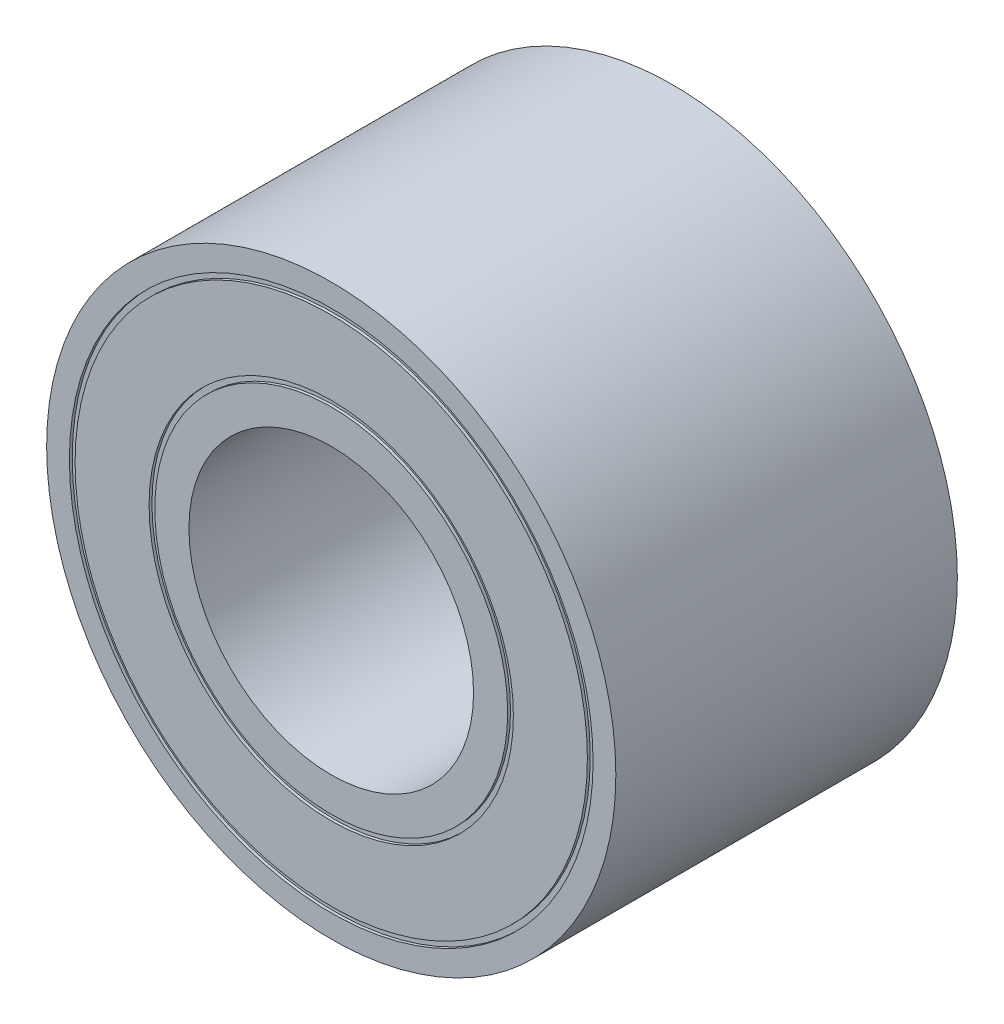
from build123d import *

# Parameters (mm, degrees)
ESBO_O1_R                = 25
ESBO_O1_R_2              = 12.5
RESSALTO_EXTRUS_O1_DEPTH = 15
ESBO_O2_R                = 23
ESBO_O2_R_2              = 22.5
ESBO_O2_R_3              = 16
ESBO_O2_R_4              = 15.5
CORTE_EXTRUS_O1_DEPTH    = 0.25


with BuildPart() as part:
    # Esboço1 → Ressalto-extrusão1 (new, symmetric)
    with BuildSketch(Plane.XY):
        Circle(ESBO_O1_R)
        Circle(ESBO_O1_R_2, mode=Mode.SUBTRACT)
    extrude(amount=RESSALTO_EXTRUS_O1_DEPTH, both=True)

    # Esboço2 → Corte-extrusão1 (cut)
    # profile 1 of 2: a face of its own
    with BuildSketch(Plane.XY.offset(15)):
        Circle(ESBO_O2_R)
        Circle(ESBO_O2_R_2, mode=Mode.SUBTRACT)
    # profile 2 of 2: a face of its own
    with BuildSketch(Plane.XY.offset(15)):
        Circle(ESBO_O2_R_3)
        Circle(ESBO_O2_R_4, mode=Mode.SUBTRACT)
    corte_extrus_o1 = extrude(amount=-CORTE_EXTRUS_O1_DEPTH, mode=Mode.SUBTRACT)

    # Espelhar1: Corte-extrusão1 across plane
    add(corte_extrus_o1.mirror(Plane.XY), mode=Mode.SUBTRACT)


solid = part.part
